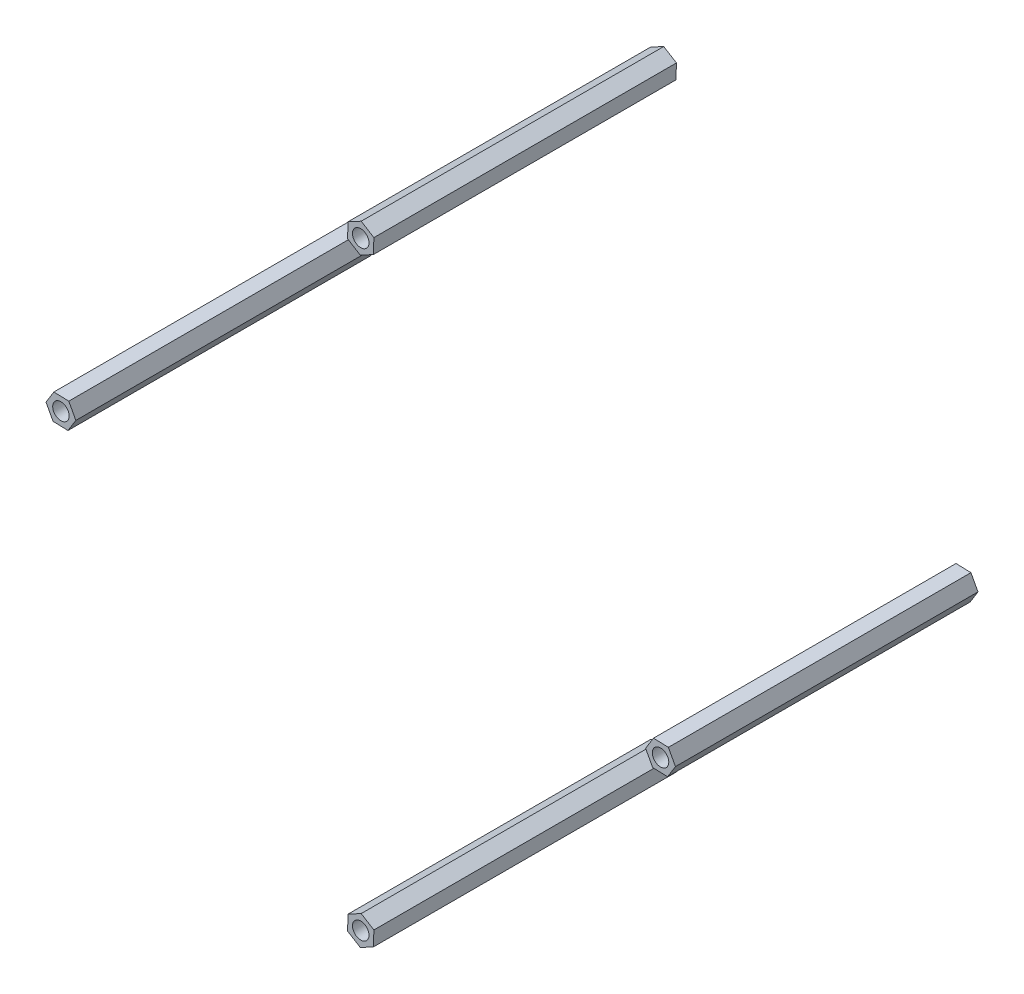
from build123d import *

# Parameters (mm, degrees)
SKETCH_1_R        = 1.5
EXTRUDE_1_DEPTH   = 55
EXTRUDE_1_2_DEPTH = 55
EXTRUDE_1_3_DEPTH = 55
EXTRUDE_1_4_DEPTH = 55


with BuildPart() as part:
    # 草图1 → 凸台-拉伸1 (new body)
    with BuildSketch(Plane.XY):
        Polygon((53.071106767, -56.806858787), (55.783351696, -56.890887232), (57.212244929, -54.584028446), (55.928893233, -52.193141213), (53.216648304, -52.109112768), (51.787755071, -54.415971554), align=None)
        with Locations((54.5, -54.5)):
            Circle(SKETCH_1_R, mode=Mode.SUBTRACT)
    extrude(amount=EXTRUDE_1_DEPTH)


with BuildPart() as body_2:
    # 草图1 → Extrude 1 2 (new body)
    with BuildSketch(Plane.XY):
        Polygon((2.306858787, -1.428893233), (2.390887232, 1.283351696), (0.084028446, 2.712244929), (-2.306858787, 1.428893233), (-2.390887232, -1.283351696), (-0.084028446, -2.712244929), align=None)
        Circle(SKETCH_1_R, mode=Mode.SUBTRACT)
    extrude(amount=EXTRUDE_1_2_DEPTH)


with BuildPart() as body_3:
    # 草图1 → Extrude 1 3 (new body)
    with BuildSketch(Plane.XY):
        Polygon((-2.306858787, -107.571106767), (-2.390887232, -110.283351696), (-0.084028446, -111.712244929), (2.306858787, -110.428893233), (2.390887232, -107.716648304), (0.084028446, -106.287755071), align=None)
        with Locations((0, -109)):
            Circle(SKETCH_1_R, mode=Mode.SUBTRACT)
    extrude(amount=EXTRUDE_1_3_DEPTH)


with BuildPart() as body_4:
    # 草图1 → Extrude 1 4 (new body)
    with BuildSketch(Plane.XY):
        Polygon((-53.071106767, -52.193141213), (-55.783351696, -52.109112768), (-57.212244929, -54.415971554), (-55.928893233, -56.806858787), (-53.216648304, -56.890887232), (-51.787755071, -54.584028446), align=None)
        with Locations((-54.5, -54.5)):
            Circle(SKETCH_1_R, mode=Mode.SUBTRACT)
    extrude(amount=EXTRUDE_1_4_DEPTH)


solid = Compound([part.part, body_2.part, body_3.part, body_4.part])
